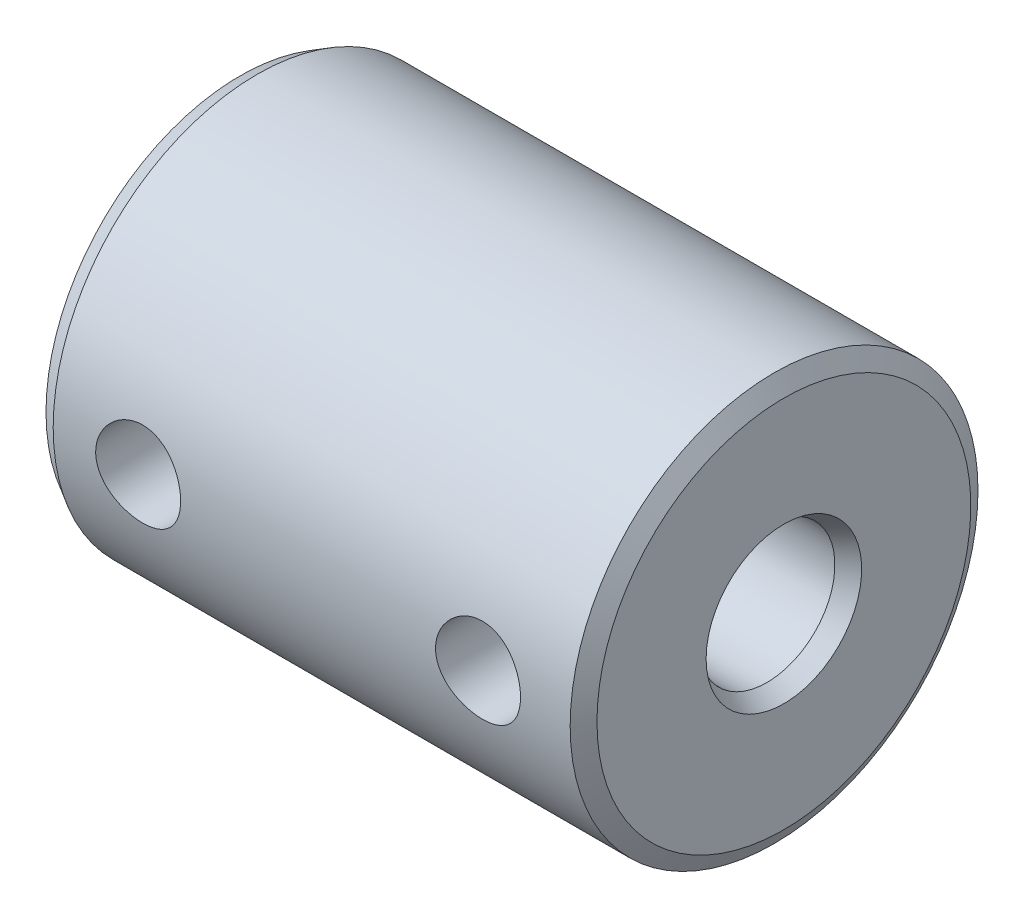
from build123d import *
from OCP.BRepFilletAPI import BRepFilletAPI_MakeChamfer

# Parameters (mm, degrees)
CHANFREIN1_SIZE            = 0.5
CHANFREIN1_SIZE2           = 0.288675135
ESQUISSE2_W                = 1.25
ESQUISSE2_H                = 6
TROU_TARAUD_M31_AT_2_COUNT = 2
TROU_TARAUD_M31_AT_2_PITCH = 10


with BuildPart() as part:
    # Esquisse1 → Révolution1 (revolve)
    with BuildSketch(Plane.XY, mode=Mode.PRIVATE) as r_volution1_sk:
        Polygon((0, 3), (0, 6), (16, 6), (16, 2), (8, 2), (8, 3), align=None)
    revolve(r_volution1_sk.sketch.rotate(Axis((0, 0, 0), (1, 0, 0)), 90), axis=Axis((0, 0, 0), (1, 0, 0)))

    # Chanfrein1: one chamfer whose edges measure the first distance from different faces: ONE call of the kernel's chamfer builder (chamfer() names one face for all edges)
    chanfrein1_edges_1 = [part.edges().sort_by_distance(p)[0] for p in [
        (16, 0, -2),
    ]]
    chanfrein1_side_1 = [part.faces().sort_by_distance(p)[0] for p in [
        (12, 0, -2),
    ]]
    chanfrein1_edges_2 = [part.edges().sort_by_distance(p)[0] for p in [
        (16, 0, -6),
    ]]
    chanfrein1_side_2 = [part.faces().sort_by_distance(p)[0] for p in [
        (16, 0, -5.830294373),
    ]]
    chanfrein1_edges_3 = [part.edges().sort_by_distance(p)[0] for p in [
        (0, 0, -6),
    ]]
    chanfrein1_side_3 = [part.faces().sort_by_distance(p)[0] for p in [
        (8, 0, -6),
    ]]
    chanfrein1_edges_4 = [part.edges().sort_by_distance(p)[0] for p in [
        (0, 0, -3),
    ]]
    chanfrein1_side_4 = [part.faces().sort_by_distance(p)[0] for p in [
        (0, 0, -3.169705627),
    ]]
    chanfrein1 = BRepFilletAPI_MakeChamfer(part.part.solid().wrapped)
    for e in chanfrein1_edges_1:
        chanfrein1.Add(CHANFREIN1_SIZE, CHANFREIN1_SIZE2, e.wrapped, chanfrein1_side_1[0].wrapped)  # the first distance lies on this face
    for e in chanfrein1_edges_2:
        chanfrein1.Add(CHANFREIN1_SIZE, CHANFREIN1_SIZE2, e.wrapped, chanfrein1_side_2[0].wrapped)  # the first distance lies on this face
    for e in chanfrein1_edges_3:
        chanfrein1.Add(CHANFREIN1_SIZE, CHANFREIN1_SIZE2, e.wrapped, chanfrein1_side_3[0].wrapped)  # the first distance lies on this face
    for e in chanfrein1_edges_4:
        chanfrein1.Add(CHANFREIN1_SIZE, CHANFREIN1_SIZE2, e.wrapped, chanfrein1_side_4[0].wrapped)  # the first distance lies on this face
    add(Compound.cast(chanfrein1.Shape()), mode=Mode.REPLACE)

    # Esquisse2 → Trou taraudé M31 (revolve, cut)
    with BuildSketch(Plane.YZ.offset(3)):
        with Locations((0.625, 3)):
            Rectangle(ESQUISSE2_W, ESQUISSE2_H)
    trou_taraud_m31 = revolve(axis=Axis((3, 0, -6.35), (0, 0, 1)), mode=Mode.SUBTRACT)

    # Trou taraudé M31 at 2: Trou taraudé M31 ×2
    with Locations(*[(i * TROU_TARAUD_M31_AT_2_PITCH, 0, 0) for i in range(1, TROU_TARAUD_M31_AT_2_COUNT)]):
        add(trou_taraud_m31, mode=Mode.SUBTRACT)


solid = part.part
